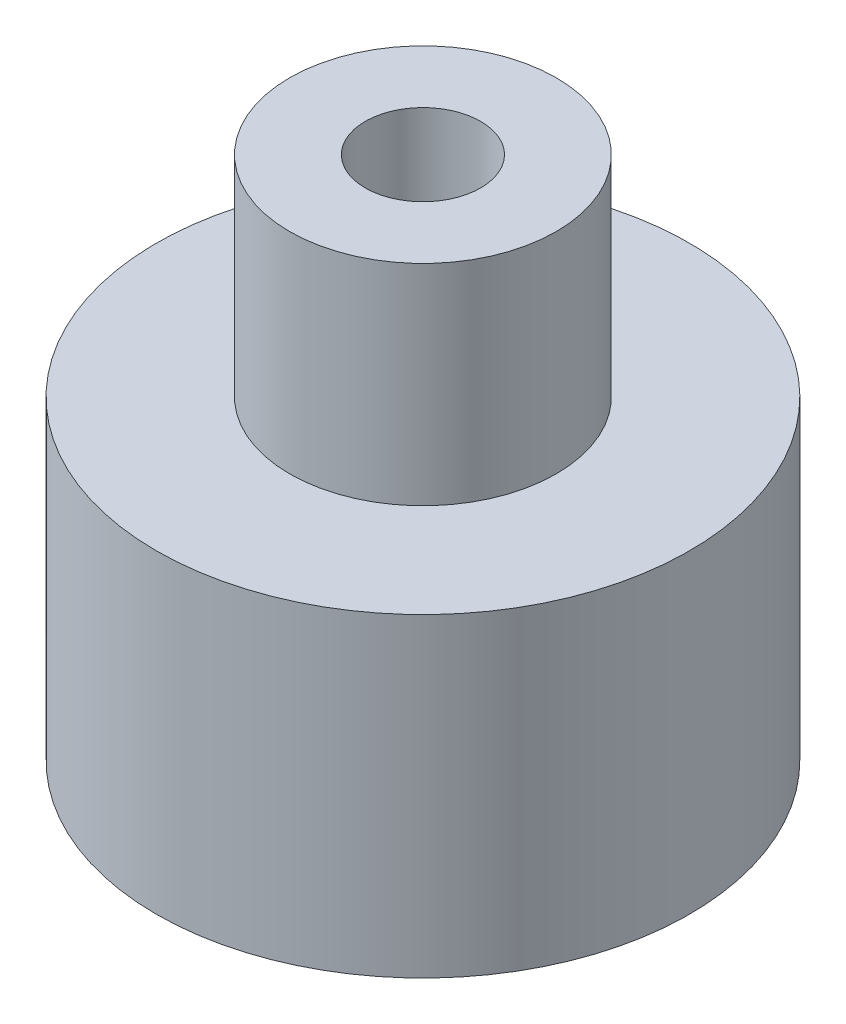
from build123d import *

# Parameters (mm, degrees)
REFRENTADO_PARA_TORNILLO_CON_CABEZA_HUEC_D           = 6.6
REFRENTADO_PARA_TORNILLO_CON_CABEZA_HUEC_CBORE_D     = 11
REFRENTADO_PARA_TORNILLO_CON_CABEZA_HUEC_CBORE_DEPTH = 36.4


with BuildPart() as part:
    # Croquis1 → Revolución1 (revolve)
    with BuildSketch(Plane.XY, mode=Mode.PRIVATE) as revoluci_n1_sk:
        Polygon((0, 50), (0, 0), (25.4, 0), (25.4, 30), (12.7, 30), (12.7, 50), align=None)
    revolve(revoluci_n1_sk.sketch.rotate(Axis((0, 50, 0), (0, -1, 0)), 90), axis=Axis((0, 50, 0), (0, -1, 0)))

    # Refrentado para tornillo con cabeza hueca de M61 (through all)
    with Locations(Plane(origin=(0, 50, 0), x_dir=(1, 0, 0), z_dir=(0, 1, 0))):
        with Locations((0, 0)):
            CounterBoreHole(REFRENTADO_PARA_TORNILLO_CON_CABEZA_HUEC_D / 2, REFRENTADO_PARA_TORNILLO_CON_CABEZA_HUEC_CBORE_D / 2, REFRENTADO_PARA_TORNILLO_CON_CABEZA_HUEC_CBORE_DEPTH)


solid = part.part
